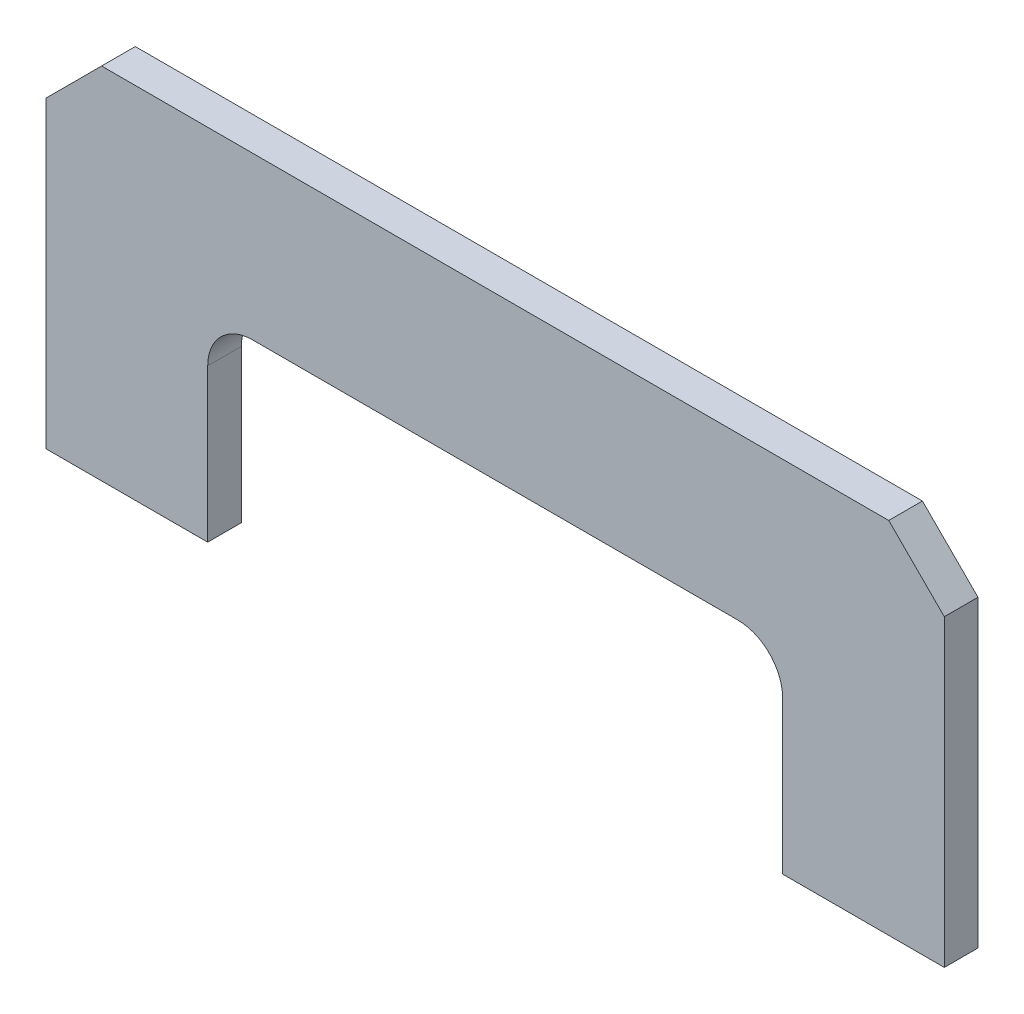
from build123d import *

# Parameters (mm, degrees)
BOSS_EXTRUDE1_DEPTH = 2.38125
FILLET1_R           = 3.175
CUT_EXTRUDE1_DEPTH  = 69.433035528


with BuildPart() as part:
    # Sketch1 → Boss-Extrude1 (new body)
    with BuildSketch(Plane.XY):
        Polygon((0, 0), (11.43, 0), (11.43, 13.97), (52.07, 13.97), (52.07, 0), (63.5, 0), (63.5, 25.4), (0, 25.4), align=None)
    extrude(amount=BOSS_EXTRUDE1_DEPTH)

    # Fillet1
    fillet1_edges = [part.edges().sort_by_distance(p)[0] for p in [
        (52.07, 13.97, 1.190625),
        (11.43, 13.97, 1.190625),
    ]]
    fillet(fillet1_edges, radius=FILLET1_R)

    # Sketch2 → Cut-Extrude1 (cut, through all)
    with BuildSketch(Plane.XY.offset(2.38125)):
        Polygon((0, 25.4), (0, 21.471137947), (3.928862053, 25.4), align=None)
        Polygon((63.5, 25.4), (59.571137947, 25.4), (63.5, 21.471137947), align=None)
    extrude(amount=-CUT_EXTRUDE1_DEPTH, mode=Mode.SUBTRACT)


solid = part.part
